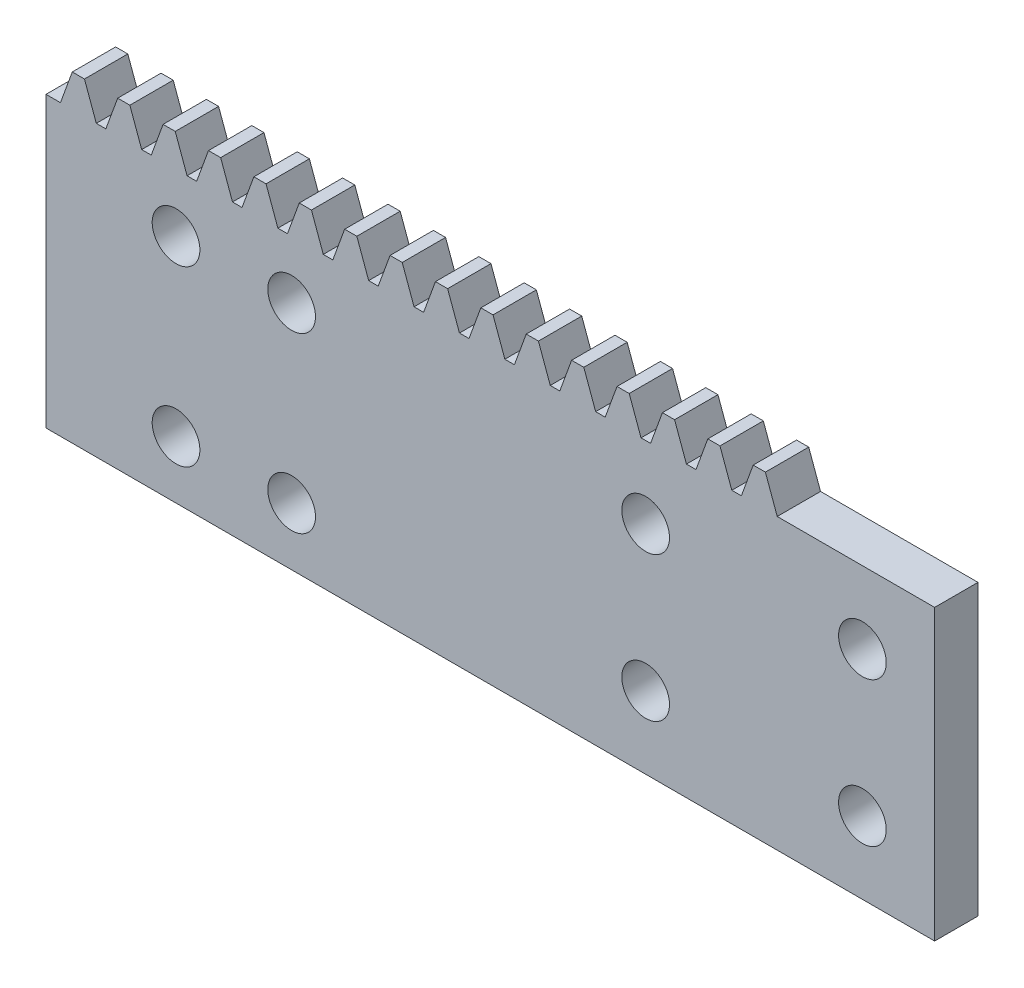
from build123d import *

# Parameters (mm, degrees)
SKETCH_1_W             = 61.5
SKETCH_1_H             = 20
EXTRUDE_1_DEPTH        = 3
EXTRUDE_2_DEPTH        = 3
PATTERN_LINEAR_1_COUNT = 16
PATTERN_LINEAR_1_PITCH = 3.141592654
CUT_EXTRUDE_1_REACH    = 35.236
SKETCH_3_R             = 1.65
CUT_EXTRUDE_2_REACH    = 35.236
SKETCH_4_R             = 1.65


with BuildPart() as part:
    # 草圖1 → 填料-伸長1 (new body)
    with BuildSketch(Plane.XY):
        Rectangle(SKETCH_1_W, SKETCH_1_H)
    extrude(amount=EXTRUDE_1_DEPTH)

    # 草圖2 → 填料-伸長2 (add)
    with BuildSketch(Plane.XY.offset(3)):
        Polygon((-29.75, 10), (-28.931066973, 12.25), (-28.088211111, 12.25), (-27.269278084, 10), align=None)
    extrude_2 = extrude(amount=-EXTRUDE_2_DEPTH)

    # 直線複製排列1: 填料-伸長2 ×16
    with Locations(*[(i * PATTERN_LINEAR_1_PITCH, 0, 0) for i in range(1, PATTERN_LINEAR_1_COUNT)]):
        add(extrude_2)

    # 草圖3 → 除料-伸長1 (cut, up to next)
    with BuildSketch(Plane.XY.offset(3), mode=Mode.PRIVATE) as cut_extrude_1_sk1:
        with Locations((-21.75, 6)):
            Circle(SKETCH_3_R)
    cut_extrude_1_tool1 = extrude(cut_extrude_1_sk1.sketch, amount=-CUT_EXTRUDE_1_REACH, mode=Mode.PRIVATE) & part.part
    # 草圖3 → 除料-伸長1 (cut, up to next)
    with BuildSketch(Plane.XY.offset(3), mode=Mode.PRIVATE) as cut_extrude_1_sk2:
        with Locations((-13.75, 6)):
            Circle(SKETCH_3_R)
    cut_extrude_1_tool2 = extrude(cut_extrude_1_sk2.sketch, amount=-CUT_EXTRUDE_1_REACH, mode=Mode.PRIVATE) & part.part
    # 草圖3 → 除料-伸長1 (cut, up to next)
    with BuildSketch(Plane.XY.offset(3), mode=Mode.PRIVATE) as cut_extrude_1_sk3:
        with Locations((-21.75, -6)):
            Circle(SKETCH_3_R)
    cut_extrude_1_tool3 = extrude(cut_extrude_1_sk3.sketch, amount=-CUT_EXTRUDE_1_REACH, mode=Mode.PRIVATE) & part.part
    # 草圖3 → 除料-伸長1 (cut, up to next)
    with BuildSketch(Plane.XY.offset(3), mode=Mode.PRIVATE) as cut_extrude_1_sk4:
        with Locations((-13.75, -6)):
            Circle(SKETCH_3_R)
    cut_extrude_1_tool4 = extrude(cut_extrude_1_sk4.sketch, amount=-CUT_EXTRUDE_1_REACH, mode=Mode.PRIVATE) & part.part
    add(cut_extrude_1_tool1.solids().sort_by_distance((-21.75, 6, 3))[0], mode=Mode.SUBTRACT)
    add(cut_extrude_1_tool2.solids().sort_by_distance((-13.75, 6, 3))[0], mode=Mode.SUBTRACT)
    add(cut_extrude_1_tool3.solids().sort_by_distance((-21.75, -6, 3))[0], mode=Mode.SUBTRACT)
    add(cut_extrude_1_tool4.solids().sort_by_distance((-13.75, -6, 3))[0], mode=Mode.SUBTRACT)

    # 草圖4 → 除料-伸長2 (cut, up to next)
    with BuildSketch(Plane.XY.offset(3), mode=Mode.PRIVATE) as cut_extrude_2_sk1:
        with Locations((25.75, 5)):
            Circle(SKETCH_4_R)
    cut_extrude_2_tool1 = extrude(cut_extrude_2_sk1.sketch, amount=-CUT_EXTRUDE_2_REACH, mode=Mode.PRIVATE) & part.part
    # 草圖4 → 除料-伸長2 (cut, up to next)
    with BuildSketch(Plane.XY.offset(3), mode=Mode.PRIVATE) as cut_extrude_2_sk2:
        with Locations((10.75, 5)):
            Circle(SKETCH_4_R)
    cut_extrude_2_tool2 = extrude(cut_extrude_2_sk2.sketch, amount=-CUT_EXTRUDE_2_REACH, mode=Mode.PRIVATE) & part.part
    # 草圖4 → 除料-伸長2 (cut, up to next)
    with BuildSketch(Plane.XY.offset(3), mode=Mode.PRIVATE) as cut_extrude_2_sk3:
        with Locations((25.75, -5)):
            Circle(SKETCH_4_R)
    cut_extrude_2_tool3 = extrude(cut_extrude_2_sk3.sketch, amount=-CUT_EXTRUDE_2_REACH, mode=Mode.PRIVATE) & part.part
    # 草圖4 → 除料-伸長2 (cut, up to next)
    with BuildSketch(Plane.XY.offset(3), mode=Mode.PRIVATE) as cut_extrude_2_sk4:
        with Locations((10.75, -5)):
            Circle(SKETCH_4_R)
    cut_extrude_2_tool4 = extrude(cut_extrude_2_sk4.sketch, amount=-CUT_EXTRUDE_2_REACH, mode=Mode.PRIVATE) & part.part
    add(cut_extrude_2_tool1.solids().sort_by_distance((25.75, 5, 3))[0], mode=Mode.SUBTRACT)
    add(cut_extrude_2_tool2.solids().sort_by_distance((10.75, 5, 3))[0], mode=Mode.SUBTRACT)
    add(cut_extrude_2_tool3.solids().sort_by_distance((25.75, -5, 3))[0], mode=Mode.SUBTRACT)
    add(cut_extrude_2_tool4.solids().sort_by_distance((10.75, -5, 3))[0], mode=Mode.SUBTRACT)


solid = part.part
